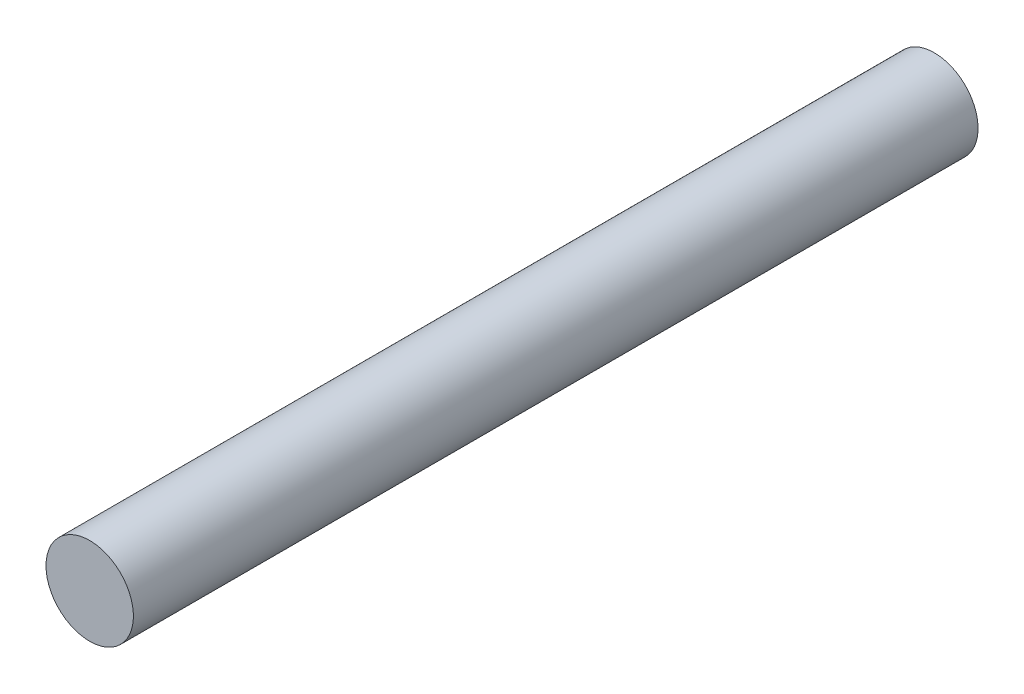
from build123d import *

# Parameters (mm, degrees)
SKETCH_1_R      = 3
EXTRUDE_1_DEPTH = 58


with BuildPart() as part:
    # ｽｹｯﾁ1 → ﾎﾞｽ - 押し出し1 (new body)
    with BuildSketch(Plane.XY):
        with Locations(Location((0, 0, 0), (0, 0, 180))):
            Circle(SKETCH_1_R)
    extrude(amount=EXTRUDE_1_DEPTH)


solid = part.part
